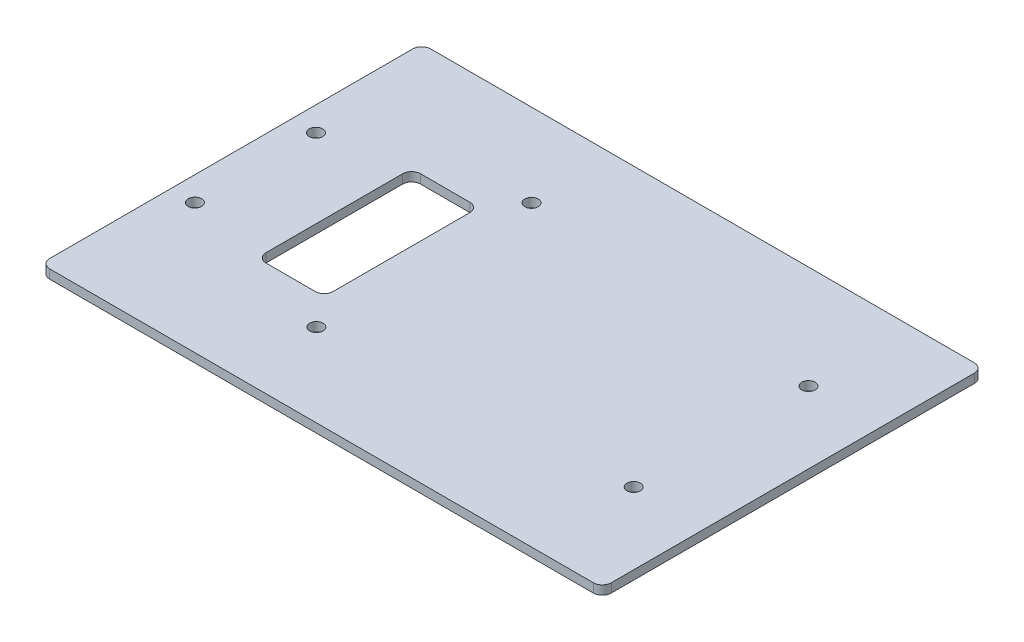
from build123d import *

# Parameters (mm, degrees)
SKETCH_1_W          = 125.3
SKETCH_1_H          = 85
SKETCH_1_R          = 1.5
SKETCH_1_W_2        = 15
SKETCH_1_H_2        = 34.5
EXTRUDE_1_DEPTH     = 2
FILLET_1_R          = 2
CUT_EXTRUDE_2_REACH = 77.732
SKETCH_2_R          = 1.5


with BuildPart() as part:
    # 草图1 → 凸台-拉伸1 (new body)
    with BuildSketch(Plane(origin=(0, 0, 0), x_dir=(1, 0, 0), z_dir=(0, 1, 0))):
        Rectangle(SKETCH_1_W, SKETCH_1_H)
        with Locations(Location((-19.65, 24, 0), (0, 0, 270))):
            Circle(SKETCH_1_R, mode=Mode.SUBTRACT)
        with Locations(Location((-19.65, -24, 0), (0, 0, 270))):
            Circle(SKETCH_1_R, mode=Mode.SUBTRACT)
        with Locations(Location((46.65, 19.5, 0), (0, 0, 270))):
            Circle(SKETCH_1_R, mode=Mode.SUBTRACT)
        with Locations(Location((46.65, -19.5, 0), (0, 0, 270))):
            Circle(SKETCH_1_R, mode=Mode.SUBTRACT)
        with Locations((-32.15, 0)):
            Rectangle(SKETCH_1_W_2, SKETCH_1_H_2, mode=Mode.SUBTRACT)
    extrude(amount=EXTRUDE_1_DEPTH)

    # 圆角1
    fillet_1_edges = [part.edges().sort_by_distance(p)[0] for p in [
        (-39.65, 1, -17.25),
        (-39.65, 1, 17.25),
        (-24.65, 1, 17.25),
        (-24.65, 1, -17.25),
        (62.65, 1, 42.5),
        (-62.65, 1, 42.5),
        (-62.65, 1, -42.5),
        (62.65, 1, -42.5),
    ]]
    fillet(fillet_1_edges, radius=FILLET_1_R)

    # 草图2 → 切除-拉伸2 (cut, up to next)
    with BuildSketch(Plane.XZ, mode=Mode.PRIVATE) as cut_extrude_2_sk1:
        with Locations(Location((-57.25, -13.5, 0), (0, 0, 270))):
            Circle(SKETCH_2_R)
    cut_extrude_2_tool1 = extrude(cut_extrude_2_sk1.sketch, amount=-CUT_EXTRUDE_2_REACH, mode=Mode.PRIVATE) & part.part
    # 草图2 → 切除-拉伸2 (cut, up to next)
    with BuildSketch(Plane.XZ, mode=Mode.PRIVATE) as cut_extrude_2_sk2:
        with Locations(Location((-57.25, 13.5, 0), (0, 0, 270))):
            Circle(SKETCH_2_R)
    cut_extrude_2_tool2 = extrude(cut_extrude_2_sk2.sketch, amount=-CUT_EXTRUDE_2_REACH, mode=Mode.PRIVATE) & part.part
    add(cut_extrude_2_tool1.solids().sort_by_distance((-57.25, 0, -13.5))[0], mode=Mode.SUBTRACT)
    add(cut_extrude_2_tool2.solids().sort_by_distance((-57.25, 0, 13.5))[0], mode=Mode.SUBTRACT)


solid = part.part
